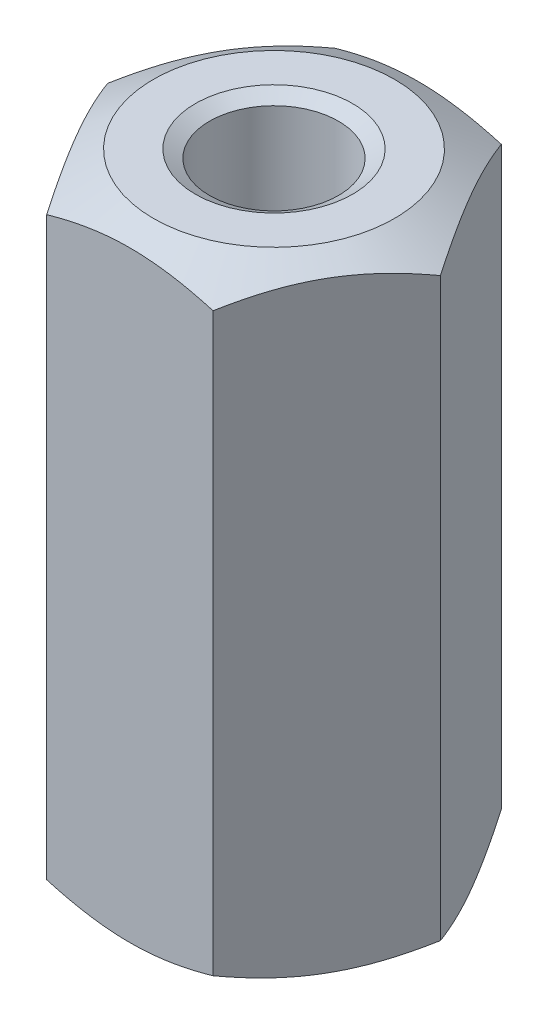
from build123d import *

# Parameters (mm, degrees)
SKIZZE2_R                       = 1.23
AUFSATZ_LINEAR_AUSTRAGEN1_DEPTH = 6
FASE1_SIZE                      = 0.27
FASE1_SIZE2                     = 0.155884573
FASE2_SIZE                      = 0.27
FASE2_SIZE2                     = 0.155884573


with BuildPart() as part:
    # Skizze2 → Aufsatz-Linear austragen1 (new, symmetric)
    with BuildSketch(Plane(origin=(0, 0, 0), x_dir=(1, 0, 0), z_dir=(0, 1, 0))):
        Polygon((3.175426481, 0), (1.58771324, 2.75), (-1.58771324, 2.75), (-3.175426481, 0), (-1.58771324, -2.75), (1.58771324, -2.75), align=None)
        with Locations(Location((0, 0, 0), (0, 0, 270))):
            Circle(SKIZZE2_R, mode=Mode.SUBTRACT)
    extrude(amount=AUFSATZ_LINEAR_AUSTRAGEN1_DEPTH, both=True)

    # Fase1
    fase1_edges = [part.edges().sort_by_distance(p)[0] for p in [
        (0, 6, -1.23),
    ]]
    fase1_side = [part.faces().sort_by_distance(p)[0] for p in [
        (2.308811699, 6, -1.332993056),
    ]]
    chamfer(fase1_edges, length=FASE1_SIZE, length2=FASE1_SIZE2, reference=fase1_side[0])

    # Fase2
    fase2_edges = [part.edges().sort_by_distance(p)[0] for p in [
        (0, -6, -1.23),
    ]]
    fase2_side = [part.faces().sort_by_distance(p)[0] for p in [
        (2.308811699, -6, -1.332993056),
    ]]
    chamfer(fase2_edges, length=FASE2_SIZE, length2=FASE2_SIZE2, reference=fase2_side[0])

    # Skizze3 → Schnitt-Rotation1 (revolve, cut)
    with BuildSketch(Plane.XY, mode=Mode.PRIVATE) as schnitt_rotation1_sk:
        Polygon((-2.3, 6), (-4.116867346, 6), (-4.116867346, 4.951031149), align=None)
        Polygon((-2.3, -6), (-4.116867346, -6), (-4.116867346, -4.951031149), align=None)
    revolve(schnitt_rotation1_sk.sketch.rotate(Axis((0, 5.844115427, 0), (0, -1, 0)), 119.99999992), axis=Axis((0, 5.844115427, 0), (0, -1, 0)), mode=Mode.SUBTRACT)


solid = part.part
